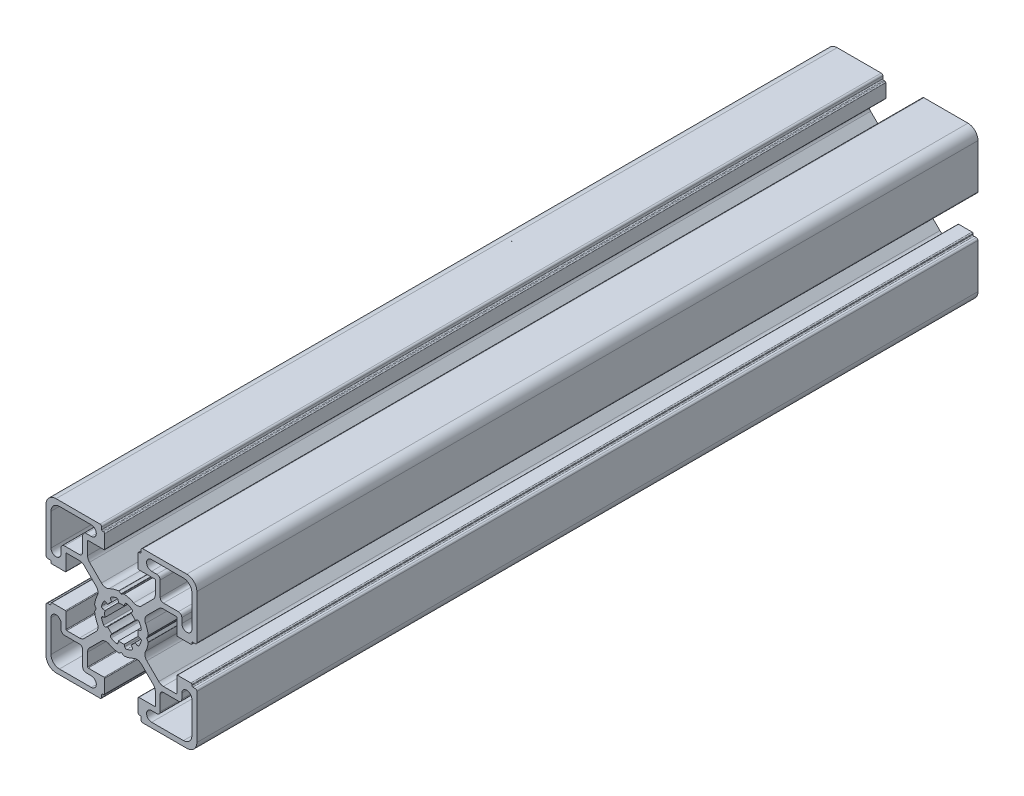
from build123d import *

# Parameters (mm, degrees)
BASE_EXTRUDE_DEPTH = 360
SKETCH2_R          = 4.2
CUT_EXTRUDE1_DEPTH = 164
SKETCH3_W          = 78.948432995
SKETCH3_H          = 70.489672317
CUT_EXTRUDE2_DEPTH = 127


with BuildPart() as part:
    # Sketch1 → Base-Extrude (new body)
    with BuildSketch(Plane.XY):
        with BuildLine():
            Line((7.973976585, 0.792591518), (7.540060475, 0.046829556))
            ThreePointArc((7.540060475, 0.046829556), (7.534295984, 0.023675638), (7.531329941, 0))
            ThreePointArc((7.531329941, 0), (7.534295984, -0.023675638), (7.540060475, -0.046829556))
            Line((7.540060475, -0.046829556), (7.973976585, -0.792591518))
            ThreePointArc((7.973976585, -0.792591518), (7.996666421, -0.851255641), (8.000014047, -0.914065683))
            ThreePointArc((8.000014047, -0.914065683), (7.719730741, -2.298395946), (7.20036345, -3.611859543))
            ThreePointArc((7.20036345, -3.611859543), (7.018857217, -4.793954471), (7.563483933, -5.85869607))
            Line((7.563483933, -5.85869607), (11.129779889, -9.424988026))
            ThreePointArc((11.129779889, -9.424988026), (11.760624613, -9.84650461), (12.504756513, -9.99452154))
            Line((12.504756513, -9.99452154), (16.316902451, -9.99452154))
            ThreePointArc((16.316902451, -9.99452154), (16.458324055, -9.935942793), (16.516902802, -9.794521189))
            Line((16.516902802, -9.794521189), (16.516902802, -5.200014226))
            ThreePointArc((16.516902802, -5.200014226), (16.575481548, -5.058592621), (16.716903152, -5.000013875))
            Line((16.716903152, -5.000013875), (20.719599904, -5.000013875))
            ThreePointArc((20.719599904, -5.000013875), (20.931731427, -5.087881629), (21.01959918, -5.300013151))
            Line((21.01959918, -5.300013151), (21.01959918, -5.500004099))
            ThreePointArc((21.01959918, -5.500004099), (21.10746708, -5.712135974), (21.319598956, -5.800003874))
            Line((21.319598956, -5.800003874), (21.999979514, -5.800003874))
            ThreePointArc((21.999979514, -5.800003874), (22.35353264, -5.946450374), (22.49997914, -6.300003501))
            Line((22.49997914, -6.300003501), (22.49997914, -19.500016116))
            ThreePointArc((22.49997914, -19.500016116), (21.62130014, -21.621334875), (19.499981381, -22.500013875))
            Line((19.499981381, -22.500013875), (6.375709012, -22.500013875))
            ThreePointArc((6.375709012, -22.500013875), (6.022155886, -22.353567375), (5.875709386, -22.000014249))
            Line((5.875709386, -22.000014249), (5.875709386, -21.30001315))
            ThreePointArc((5.875709386, -21.30001315), (5.787841632, -21.087881628), (5.57571011, -21.000013874))
            Line((5.57571011, -21.000013874), (5.299998776, -21.000013874))
            ThreePointArc((5.299998776, -21.000013874), (5.087867607, -20.912146267), (5, -20.700015099))
            Line((5, -20.700015099), (5, -16.666812433))
            ThreePointArc((5, -16.666812433), (5.058578893, -16.525390475), (5.200000851, -16.466811582))
            Line((5.200000851, -16.466811582), (9.905385218, -16.466811582))
            ThreePointArc((9.905385218, -16.466811582), (10.046806822, -16.408232835), (10.105385569, -16.266811231))
            Line((10.105385569, -16.266811231), (10.105385569, -12.471582956))
            ThreePointArc((10.105385569, -12.471582956), (9.953144588, -11.706215861), (9.519598955, -11.057368968))
            Line((9.519598955, -11.057368968), (5.944897989, -7.482668002))
            ThreePointArc((5.944897989, -7.482668002), (4.854601835, -6.967833724), (3.666499237, -7.173289937))
            ThreePointArc((3.666499237, -7.173289937), (2.309136684, -7.713848333), (0.876396038, -8.000013875))
            ThreePointArc((0.876396038, -8.000013875), (0.81356491, -7.997088573), (0.754749577, -7.974793627))
            Line((0.754749577, -7.974793627), (0.11262846, -7.606936933))
            ThreePointArc((0.11262846, -7.606936933), (0.062963903, -7.559088739), (0, -7.530953975))
            ThreePointArc((0, -7.530953975), (-0.062963903, -7.559088739), (-0.11262846, -7.606936933))
            Line((-0.11262846, -7.606936933), (-0.754749577, -7.974793627))
            ThreePointArc((-0.754749577, -7.974793627), (-0.81356491, -7.997088573), (-0.876396038, -8.000013875))
            ThreePointArc((-0.876396038, -8.000013875), (-2.309136684, -7.713848333), (-3.666499237, -7.173289937))
            ThreePointArc((-3.666499237, -7.173289937), (-4.854601835, -6.967833724), (-5.944897989, -7.482668002))
            Line((-5.944897989, -7.482668002), (-9.519598955, -11.057368968))
            ThreePointArc((-9.519598955, -11.057368968), (-9.953144588, -11.706215861), (-10.105385569, -12.471582956))
            Line((-10.105385569, -12.471582956), (-10.105385569, -16.266811231))
            ThreePointArc((-10.105385569, -16.266811231), (-10.046806822, -16.408232835), (-9.905385218, -16.466811582))
            Line((-9.905385218, -16.466811582), (-5.200000851, -16.466811582))
            ThreePointArc((-5.200000851, -16.466811582), (-5.058578893, -16.525390475), (-5, -16.666812433))
            Line((-5, -16.666812433), (-5, -20.700015099))
            ThreePointArc((-5, -20.700015099), (-5.087867607, -20.912146267), (-5.299998776, -21.000013874))
            Line((-5.299998776, -21.000013874), (-5.57571011, -21.000013874))
            ThreePointArc((-5.57571011, -21.000013874), (-5.787841632, -21.087881628), (-5.875709386, -21.30001315))
            Line((-5.875709386, -21.30001315), (-5.875709386, -22.000014249))
            ThreePointArc((-5.875709386, -22.000014249), (-6.022155886, -22.353567375), (-6.375709012, -22.500013875))
            Line((-6.375709012, -22.500013875), (-19.499981381, -22.500013875))
            ThreePointArc((-19.499981381, -22.500013875), (-21.62130014, -21.621334875), (-22.49997914, -19.500016116))
            Line((-22.49997914, -19.500016116), (-22.49997914, -6.300003501))
            ThreePointArc((-22.49997914, -6.300003501), (-22.35353264, -5.946450374), (-21.999979514, -5.800003874))
            Line((-21.999979514, -5.800003874), (-21.319598956, -5.800003874))
            ThreePointArc((-21.319598956, -5.800003874), (-21.10746708, -5.712135974), (-21.01959918, -5.500004099))
            Line((-21.01959918, -5.500004099), (-21.01959918, -5.300013151))
            ThreePointArc((-21.01959918, -5.300013151), (-20.931731427, -5.087881629), (-20.719599904, -5.000013875))
            Line((-20.719599904, -5.000013875), (-16.716903152, -5.000013875))
            ThreePointArc((-16.716903152, -5.000013875), (-16.575481548, -5.058592621), (-16.516902802, -5.200014226))
            Line((-16.516902802, -5.200014226), (-16.516902802, -9.794521189))
            ThreePointArc((-16.516902802, -9.794521189), (-16.458324055, -9.935942793), (-16.316902451, -9.99452154))
            Line((-16.316902451, -9.99452154), (-12.504756513, -9.99452154))
            ThreePointArc((-12.504756513, -9.99452154), (-11.760624613, -9.84650461), (-11.129779889, -9.424988026))
            Line((-11.129779889, -9.424988026), (-7.563483933, -5.85869607))
            ThreePointArc((-7.563483933, -5.85869607), (-7.018857217, -4.793954471), (-7.20036345, -3.611859543))
            ThreePointArc((-7.20036345, -3.611859543), (-7.719730741, -2.298395946), (-8.000014047, -0.914065683))
            ThreePointArc((-8.000014047, -0.914065683), (-7.996666421, -0.851255641), (-7.973976585, -0.792591518))
            Line((-7.973976585, -0.792591518), (-7.540060475, -0.046829556))
            ThreePointArc((-7.540060475, -0.046829556), (-7.534295984, -0.023675638), (-7.531329941, 0))
            ThreePointArc((-7.531329941, 0), (-7.534295984, 0.023675638), (-7.540060475, 0.046829556))
            Line((-7.540060475, 0.046829556), (-7.973976585, 0.792591518))
            ThreePointArc((-7.973976585, 0.792591518), (-7.996666421, 0.851255641), (-8.000014047, 0.914065683))
            ThreePointArc((-8.000014047, 0.914065683), (-7.719730741, 2.298395946), (-7.20036345, 3.611859543))
            ThreePointArc((-7.20036345, 3.611859543), (-7.018857217, 4.793954471), (-7.563483933, 5.85869607))
            Line((-7.563483933, 5.85869607), (-11.129779889, 9.424988026))
            ThreePointArc((-11.129779889, 9.424988026), (-11.760624613, 9.84650461), (-12.504756513, 9.99452154))
            Line((-12.504756513, 9.99452154), (-16.316902451, 9.99452154))
            ThreePointArc((-16.316902451, 9.99452154), (-16.458324055, 9.935942793), (-16.516902802, 9.794521189))
            Line((-16.516902802, 9.794521189), (-16.516902802, 5.200014226))
            ThreePointArc((-16.516902802, 5.200014226), (-16.575481548, 5.058592621), (-16.716903152, 5.000013875))
            Line((-16.716903152, 5.000013875), (-20.719599904, 5.000013875))
            ThreePointArc((-20.719599904, 5.000013875), (-20.931731427, 5.087881629), (-21.01959918, 5.300013151))
            Line((-21.01959918, 5.300013151), (-21.01959918, 5.500004099))
            ThreePointArc((-21.01959918, 5.500004099), (-21.10746708, 5.712135974), (-21.319598956, 5.800003874))
            Line((-21.319598956, 5.800003874), (-21.999979514, 5.800003874))
            ThreePointArc((-21.999979514, 5.800003874), (-22.35353264, 5.946450374), (-22.49997914, 6.300003501))
            Line((-22.49997914, 6.300003501), (-22.49997914, 19.500016116))
            ThreePointArc((-22.49997914, 19.500016116), (-21.62130014, 21.621334875), (-19.499981381, 22.500013875))
            Line((-19.499981381, 22.500013875), (-6.375709012, 22.500013875))
            ThreePointArc((-6.375709012, 22.500013875), (-6.022155886, 22.353567375), (-5.875709386, 22.000014249))
            Line((-5.875709386, 22.000014249), (-5.875709386, 21.30001315))
            ThreePointArc((-5.875709386, 21.30001315), (-5.787841632, 21.087881628), (-5.57571011, 21.000013874))
            Line((-5.57571011, 21.000013874), (-5.299998776, 21.000013874))
            ThreePointArc((-5.299998776, 21.000013874), (-5.087867607, 20.912146267), (-5, 20.700015099))
            Line((-5, 20.700015099), (-5, 16.666812433))
            ThreePointArc((-5, 16.666812433), (-5.058578893, 16.525390475), (-5.200000851, 16.466811582))
            Line((-5.200000851, 16.466811582), (-9.905385218, 16.466811582))
            ThreePointArc((-9.905385218, 16.466811582), (-10.046806822, 16.408232835), (-10.105385569, 16.266811231))
            Line((-10.105385569, 16.266811231), (-10.105385569, 12.471582956))
            ThreePointArc((-10.105385569, 12.471582956), (-9.953144588, 11.706215861), (-9.519598955, 11.057368968))
            Line((-9.519598955, 11.057368968), (-5.944897989, 7.482668002))
            ThreePointArc((-5.944897989, 7.482668002), (-4.854601835, 6.967833724), (-3.666499237, 7.173289937))
            ThreePointArc((-3.666499237, 7.173289937), (-2.309136684, 7.713848333), (-0.876396038, 8.000013875))
            ThreePointArc((-0.876396038, 8.000013875), (-0.81356491, 7.997088573), (-0.754749577, 7.974793627))
            Line((-0.754749577, 7.974793627), (-0.11262846, 7.606936933))
            ThreePointArc((-0.11262846, 7.606936933), (-0.062963903, 7.559088739), (0, 7.530953975))
            ThreePointArc((0, 7.530953975), (0.062963903, 7.559088739), (0.11262846, 7.606936933))
            Line((0.11262846, 7.606936933), (0.754749577, 7.974793627))
            ThreePointArc((0.754749577, 7.974793627), (0.81356491, 7.997088573), (0.876396038, 8.000013875))
            ThreePointArc((0.876396038, 8.000013875), (2.309136684, 7.713848333), (3.666499237, 7.173289937))
            ThreePointArc((3.666499237, 7.173289937), (4.854601835, 6.967833724), (5.944897989, 7.482668002))
            Line((5.944897989, 7.482668002), (9.519598955, 11.057368968))
            ThreePointArc((9.519598955, 11.057368968), (9.953144588, 11.706215861), (10.105385569, 12.471582956))
            Line((10.105385569, 12.471582956), (10.105385569, 16.266811231))
            ThreePointArc((10.105385569, 16.266811231), (10.046806822, 16.408232835), (9.905385218, 16.466811582))
            Line((9.905385218, 16.466811582), (5.200000851, 16.466811582))
            ThreePointArc((5.200000851, 16.466811582), (5.058578893, 16.525390475), (5, 16.666812433))
            Line((5, 16.666812433), (5, 20.700015099))
            ThreePointArc((5, 20.700015099), (5.087867607, 20.912146267), (5.299998776, 21.000013874))
            Line((5.299998776, 21.000013874), (5.57571011, 21.000013874))
            ThreePointArc((5.57571011, 21.000013874), (5.787841632, 21.087881628), (5.875709386, 21.30001315))
            Line((5.875709386, 21.30001315), (5.875709386, 22.000014249))
            ThreePointArc((5.875709386, 22.000014249), (6.022155886, 22.353567375), (6.375709012, 22.500013875))
            Line((6.375709012, 22.500013875), (19.499981381, 22.500013875))
            ThreePointArc((19.499981381, 22.500013875), (21.62130014, 21.621334875), (22.49997914, 19.500016116))
            Line((22.49997914, 19.500016116), (22.49997914, 6.300003501))
            ThreePointArc((22.49997914, 6.300003501), (22.35353264, 5.946450374), (21.999979514, 5.800003874))
            Line((21.999979514, 5.800003874), (21.319598956, 5.800003874))
            ThreePointArc((21.319598956, 5.800003874), (21.10746708, 5.712135974), (21.01959918, 5.500004099))
            Line((21.01959918, 5.500004099), (21.01959918, 5.300013151))
            ThreePointArc((21.01959918, 5.300013151), (20.931731427, 5.087881629), (20.719599904, 5.000013875))
            Line((20.719599904, 5.000013875), (16.716903152, 5.000013875))
            ThreePointArc((16.716903152, 5.000013875), (16.575481548, 5.058592621), (16.516902802, 5.200014226))
            Line((16.516902802, 5.200014226), (16.516902802, 9.794521189))
            ThreePointArc((16.516902802, 9.794521189), (16.458324055, 9.935942793), (16.316902451, 9.99452154))
            Line((16.316902451, 9.99452154), (12.504756513, 9.99452154))
            ThreePointArc((12.504756513, 9.99452154), (11.760624613, 9.84650461), (11.129779889, 9.424988026))
            Line((11.129779889, 9.424988026), (7.563483933, 5.85869607))
            ThreePointArc((7.563483933, 5.85869607), (7.018857217, 4.793954471), (7.20036345, 3.611859543))
            ThreePointArc((7.20036345, 3.611859543), (7.719730741, 2.298395946), (8.000014047, 0.914065683))
            ThreePointArc((8.000014047, 0.914065683), (7.996666421, 0.851255641), (7.973976585, 0.792591518))
        make_face()
        with BuildLine():
            Line((10.549978885, 18.000013874), (8.999979138, 18.000013874))
            ThreePointArc((8.999979138, 18.000013874), (7.499979138, 19.500013874), (8.999979138, 21.000013874))
            Line((8.999979138, 21.000013874), (18.499981006, 21.000013874))
            ThreePointArc((18.499981006, 21.000013874), (20.267746638, 20.267781374), (20.999979138, 18.500015742))
            Line((20.999979138, 18.500015742), (20.999979138, 9.000204874))
            ThreePointArc((20.999979138, 9.000204874), (19.499979138, 7.500204874), (17.999979138, 9.000204874))
            Line((17.999979138, 9.000204874), (17.999979138, 10.550013621))
            ThreePointArc((17.999979138, 10.550013621), (17.707086138, 11.257119874), (16.999979885, 11.550012874))
            Line((16.999979885, 11.550012874), (12.549977391, 11.550012874))
            ThreePointArc((12.549977391, 11.550012874), (11.842871138, 11.842905874), (11.549978138, 12.550012127))
            Line((11.549978138, 12.550012127), (11.549978138, 17.000014621))
            ThreePointArc((11.549978138, 17.000014621), (11.257085138, 17.707120874), (10.549978885, 18.000013874))
        make_face(mode=Mode.SUBTRACT)
        with BuildLine():
            Line((-0.867388737, 4.924188946), (-0.96752168, 5.481112935))
            ThreePointArc((-0.96752168, 5.481112935), (-1.187855719, 5.829589164), (-1.595071417, 5.894072848))
            ThreePointArc((-1.595071417, 5.894072848), (-2.338895973, 5.643477696), (-3.04438497, 5.299445466))
            ThreePointArc((-3.04438497, 5.299445466), (-3.284615367, 4.964275075), (-3.191311906, 4.562598216))
            Line((-3.191311906, 4.562598216), (-2.864000421, 4.09847552))
            ThreePointArc((-2.864000421, 4.09847552), (-3.53013295, 3.540926624), (-4.08971289, 2.876499344))
            Line((-4.08971289, 2.876499344), (-4.566777651, 3.208162503))
            ThreePointArc((-4.566777651, 3.208162503), (-4.968960845, 3.298770682), (-5.302497889, 3.056460542))
            ThreePointArc((-5.302497889, 3.056460542), (-5.651259984, 2.353310881), (-5.906847665, 1.611199444))
            ThreePointArc((-5.906847665, 1.611199444), (-5.839752063, 1.204293023), (-5.489730697, 0.98621116))
            Line((-5.489730697, 0.98621116), (-4.920545766, 0.887822825))
            ThreePointArc((-4.920545766, 0.887822825), (-4.980096828, 0.445685524), (-5, 0))
            ThreePointArc((-5, 0), (-4.980096828, -0.445685524), (-4.920545766, -0.887822825))
            Line((-4.920545766, -0.887822825), (-5.489730697, -0.98621116))
            ThreePointArc((-5.489730697, -0.98621116), (-5.839752063, -1.204293023), (-5.906847665, -1.611199444))
            ThreePointArc((-5.906847665, -1.611199444), (-5.651259984, -2.353310881), (-5.302497889, -3.056460542))
            ThreePointArc((-5.302497889, -3.056460542), (-4.968960845, -3.298770682), (-4.566777651, -3.208162503))
            Line((-4.566777651, -3.208162503), (-4.08971289, -2.876499344))
            ThreePointArc((-4.08971289, -2.876499344), (-3.53013295, -3.540926624), (-2.864000421, -4.09847552))
            Line((-2.864000421, -4.09847552), (-3.191311906, -4.562598216))
            ThreePointArc((-3.191311906, -4.562598216), (-3.284615367, -4.964275075), (-3.04438497, -5.299445466))
            ThreePointArc((-3.04438497, -5.299445466), (-2.338895973, -5.643477696), (-1.595071417, -5.894072848))
            ThreePointArc((-1.595071417, -5.894072848), (-1.187855719, -5.829589164), (-0.96752168, -5.481112935))
            Line((-0.96752168, -5.481112935), (-0.867388737, -4.924188946))
            ThreePointArc((-0.867388737, -4.924188946), (0, -5), (0.867388737, -4.924188946))
            Line((0.867388737, -4.924188946), (0.96752168, -5.481112935))
            ThreePointArc((0.96752168, -5.481112935), (1.187855719, -5.829589164), (1.595071417, -5.894072848))
            ThreePointArc((1.595071417, -5.894072848), (2.338895973, -5.643477696), (3.04438497, -5.299445466))
            ThreePointArc((3.04438497, -5.299445466), (3.284615367, -4.964275075), (3.191311906, -4.562598216))
            Line((3.191311906, -4.562598216), (2.864000421, -4.09847552))
            ThreePointArc((2.864000421, -4.09847552), (3.53013295, -3.540926624), (4.08971289, -2.876499344))
            Line((4.08971289, -2.876499344), (4.566777651, -3.208162503))
            ThreePointArc((4.566777651, -3.208162503), (4.968960845, -3.298770682), (5.302497889, -3.056460542))
            ThreePointArc((5.302497889, -3.056460542), (5.651259984, -2.353310881), (5.906847665, -1.611199444))
            ThreePointArc((5.906847665, -1.611199444), (5.839752063, -1.204293023), (5.489730697, -0.98621116))
            Line((5.489730697, -0.98621116), (4.920545766, -0.887822825))
            ThreePointArc((4.920545766, -0.887822825), (4.980096828, -0.445685524), (5, 0))
            ThreePointArc((5, 0), (4.980096828, 0.445685524), (4.920545766, 0.887822825))
            Line((4.920545766, 0.887822825), (5.489730697, 0.98621116))
            ThreePointArc((5.489730697, 0.98621116), (5.839752063, 1.204293023), (5.906847665, 1.611199444))
            ThreePointArc((5.906847665, 1.611199444), (5.651259984, 2.353310881), (5.302497889, 3.056460542))
            ThreePointArc((5.302497889, 3.056460542), (4.968960845, 3.298770682), (4.566777651, 3.208162503))
            Line((4.566777651, 3.208162503), (4.08971289, 2.876499344))
            ThreePointArc((4.08971289, 2.876499344), (3.53013295, 3.540926624), (2.864000421, 4.09847552))
            Line((2.864000421, 4.09847552), (3.191311906, 4.562598216))
            ThreePointArc((3.191311906, 4.562598216), (3.284615367, 4.964275075), (3.04438497, 5.299445466))
            ThreePointArc((3.04438497, 5.299445466), (2.338895973, 5.643477696), (1.595071417, 5.894072848))
            ThreePointArc((1.595071417, 5.894072848), (1.187855719, 5.829589164), (0.96752168, 5.481112935))
            Line((0.96752168, 5.481112935), (0.867388737, 4.924188946))
            ThreePointArc((0.867388737, 4.924188946), (0, 5), (-0.867388737, 4.924188946))
        make_face(mode=Mode.SUBTRACT)
        with BuildLine():
            Line((-10.549978885, -18.000013874), (-8.999979138, -18.000013874))
            ThreePointArc((-8.999979138, -18.000013874), (-7.499979138, -19.500013874), (-8.999979138, -21.000013874))
            Line((-8.999979138, -21.000013874), (-18.499981006, -21.000013874))
            ThreePointArc((-18.499981006, -21.000013874), (-20.267746638, -20.267781374), (-20.999979138, -18.500015742))
            Line((-20.999979138, -18.500015742), (-20.999979138, -9.000204874))
            ThreePointArc((-20.999979138, -9.000204874), (-19.499979138, -7.500204874), (-17.999979138, -9.000204874))
            Line((-17.999979138, -9.000204874), (-17.999979138, -10.550013621))
            ThreePointArc((-17.999979138, -10.550013621), (-17.707086138, -11.257119874), (-16.999979885, -11.550012874))
            Line((-16.999979885, -11.550012874), (-12.549977391, -11.550012874))
            ThreePointArc((-12.549977391, -11.550012874), (-11.842871138, -11.842905874), (-11.549978138, -12.550012127))
            Line((-11.549978138, -12.550012127), (-11.549978138, -17.000014621))
            ThreePointArc((-11.549978138, -17.000014621), (-11.257085138, -17.707120874), (-10.549978885, -18.000013874))
        make_face(mode=Mode.SUBTRACT)
        with BuildLine():
            Line((-11.549978138, 12.550012127), (-11.549978138, 17.000014621))
            ThreePointArc((-11.549978138, 17.000014621), (-11.257085138, 17.707120874), (-10.549978885, 18.000013874))
            Line((-10.549978885, 18.000013874), (-8.999979138, 18.000013874))
            ThreePointArc((-8.999979138, 18.000013874), (-7.499979138, 19.500013874), (-8.999979138, 21.000013874))
            Line((-8.999979138, 21.000013874), (-18.499981006, 21.000013874))
            ThreePointArc((-18.499981006, 21.000013874), (-20.267746638, 20.267781374), (-20.999979138, 18.500015742))
            Line((-20.999979138, 18.500015742), (-20.999979138, 9.000204874))
            ThreePointArc((-20.999979138, 9.000204874), (-19.499979138, 7.500204874), (-17.999979138, 9.000204874))
            Line((-17.999979138, 9.000204874), (-17.999979138, 10.550013621))
            ThreePointArc((-17.999979138, 10.550013621), (-17.707086138, 11.257119874), (-16.999979885, 11.550012874))
            Line((-16.999979885, 11.550012874), (-12.549977391, 11.550012874))
            ThreePointArc((-12.549977391, 11.550012874), (-11.842871138, 11.842905874), (-11.549978138, 12.550012127))
        make_face(mode=Mode.SUBTRACT)
        with BuildLine():
            Line((11.549978138, -12.550012127), (11.549978138, -17.000014621))
            ThreePointArc((11.549978138, -17.000014621), (11.257085138, -17.707120874), (10.549978885, -18.000013874))
            Line((10.549978885, -18.000013874), (8.999979138, -18.000013874))
            ThreePointArc((8.999979138, -18.000013874), (7.499979138, -19.500013874), (8.999979138, -21.000013874))
            Line((8.999979138, -21.000013874), (18.499981006, -21.000013874))
            ThreePointArc((18.499981006, -21.000013874), (20.267746638, -20.267781374), (20.999979138, -18.500015742))
            Line((20.999979138, -18.500015742), (20.999979138, -9.000204874))
            ThreePointArc((20.999979138, -9.000204874), (19.499979138, -7.500204874), (17.999979138, -9.000204874))
            Line((17.999979138, -9.000204874), (17.999979138, -10.550013621))
            ThreePointArc((17.999979138, -10.550013621), (17.707086138, -11.257119874), (16.999979885, -11.550012874))
            Line((16.999979885, -11.550012874), (12.549977391, -11.550012874))
            ThreePointArc((12.549977391, -11.550012874), (11.842871138, -11.842905874), (11.549978138, -12.550012127))
        make_face(mode=Mode.SUBTRACT)
    extrude(amount=-BASE_EXTRUDE_DEPTH)

    # Sketch2 → Cut-Extrude1 (cut)
    with BuildSketch(Plane(origin=(22.49997914, 0, 0), x_dir=(0, 0, -1), z_dir=(1, 0, 0))):
        with Locations(Location((85, 0, 0), (0, 0, 102.623394564))):
            Circle(SKETCH2_R)
        with Locations(Location((45, 0, 0), (0, 0, 102.623394564))):
            Circle(SKETCH2_R)
    extrude(amount=-CUT_EXTRUDE1_DEPTH, mode=Mode.SUBTRACT)

    # Sketch3 → Cut-Extrude2 (cut)
    with BuildSketch(Plane.XY):
        with Locations((4.053156159, -6.755260264)):
            Rectangle(SKETCH3_W, SKETCH3_H)
    extrude(amount=-CUT_EXTRUDE2_DEPTH, mode=Mode.SUBTRACT)


solid = part.part
